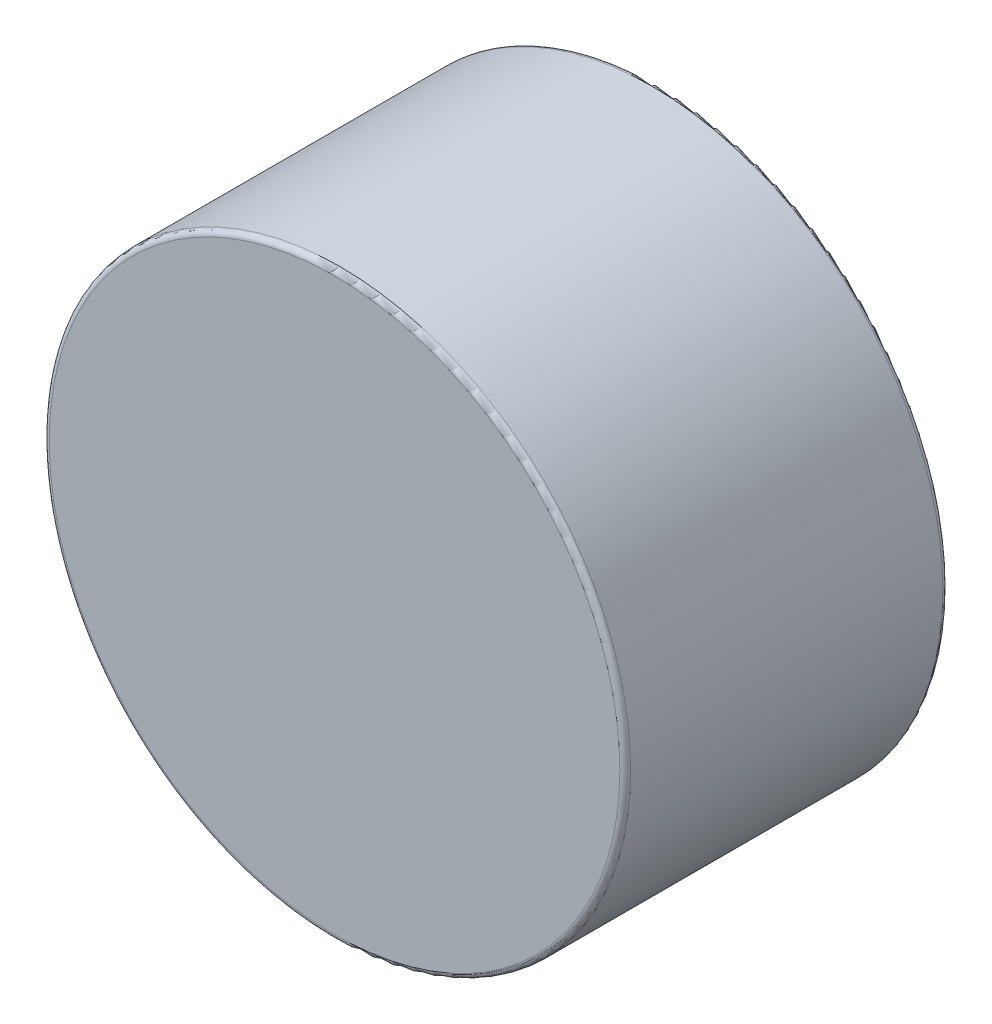
from build123d import *

# Parameters (mm, degrees)
SKETCH1_R           = 27
BOSS_EXTRUDE1_DEPTH = 15
FILLET1_R           = 0.5


with BuildPart() as part:
    # Sketch1 → Boss-Extrude1 (new, symmetric)
    with BuildSketch(Plane.XY):
        Circle(SKETCH1_R)
    extrude(amount=BOSS_EXTRUDE1_DEPTH, both=True)

    # Fillet1
    fillet1_edges = [part.edges().sort_by_distance(p)[0] for p in [
        (-27, 0, -15),
        (-27, 0, 15),
    ]]
    fillet(fillet1_edges, radius=FILLET1_R)


solid = part.part
